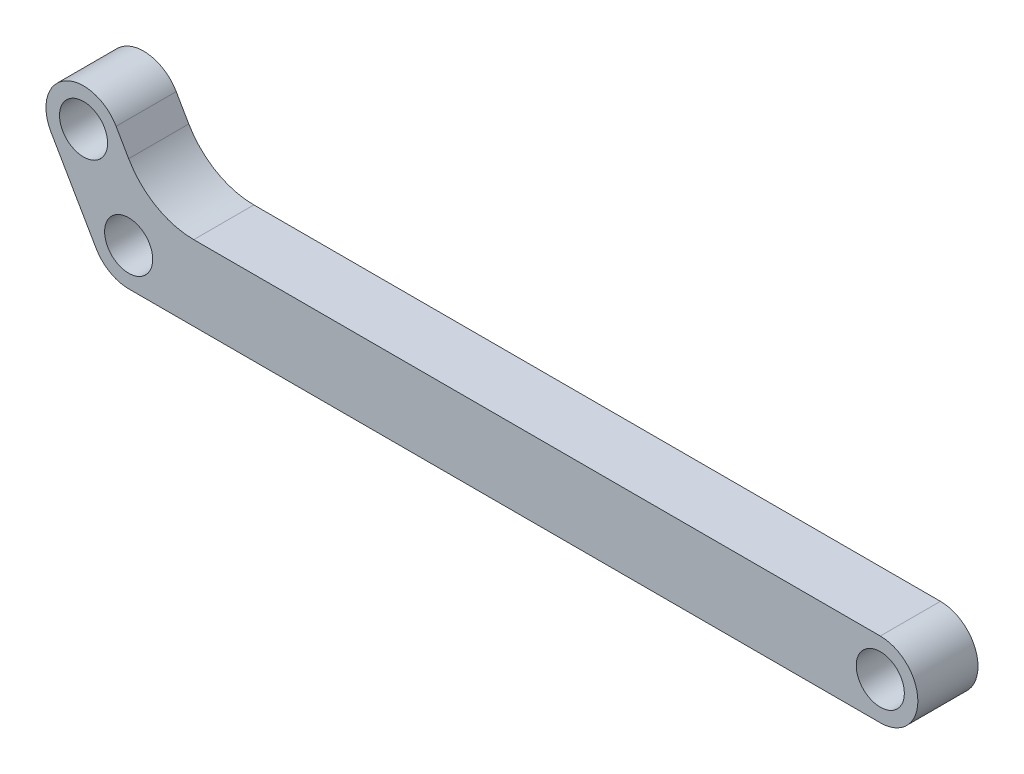
from build123d import *

# Parameters (mm, degrees)
SKETCH_1_R      = 1.6
EXTRUDE_1_DEPTH = 4


with BuildPart() as part:
    # ｽｹｯﾁ1 → ﾎﾞｽ - 押し出し1 (new body)
    with BuildSketch(Plane.XY):
        with BuildLine():
            Line((-5.165063509, 3.946152423), (-2.165063509, -1.25))
            ThreePointArc((-2.165063509, -1.25), (-1.25, -2.165063509), (0, -2.5))
            Line((0, -2.5), (50, -2.5))
            ThreePointArc((50, -2.5), (52.5, 0), (50, 2.5))
            Line((50, 2.5), (4.330127019, 2.5))
            ThreePointArc((4.330127019, 2.5), (1.830127019, 3.169872981), (0, 5))
            Line((0, 5), (-0.834936491, 6.446152423))
            ThreePointArc((-0.834936491, 6.446152423), (-4.25, 7.361215932), (-5.165063509, 3.946152423))
        make_face()
        with Locations((-3, 5.196152423)):
            Circle(SKETCH_1_R, mode=Mode.SUBTRACT)
        Circle(SKETCH_1_R, mode=Mode.SUBTRACT)
        with Locations((50, 0)):
            Circle(SKETCH_1_R, mode=Mode.SUBTRACT)
    extrude(amount=EXTRUDE_1_DEPTH)


solid = part.part
